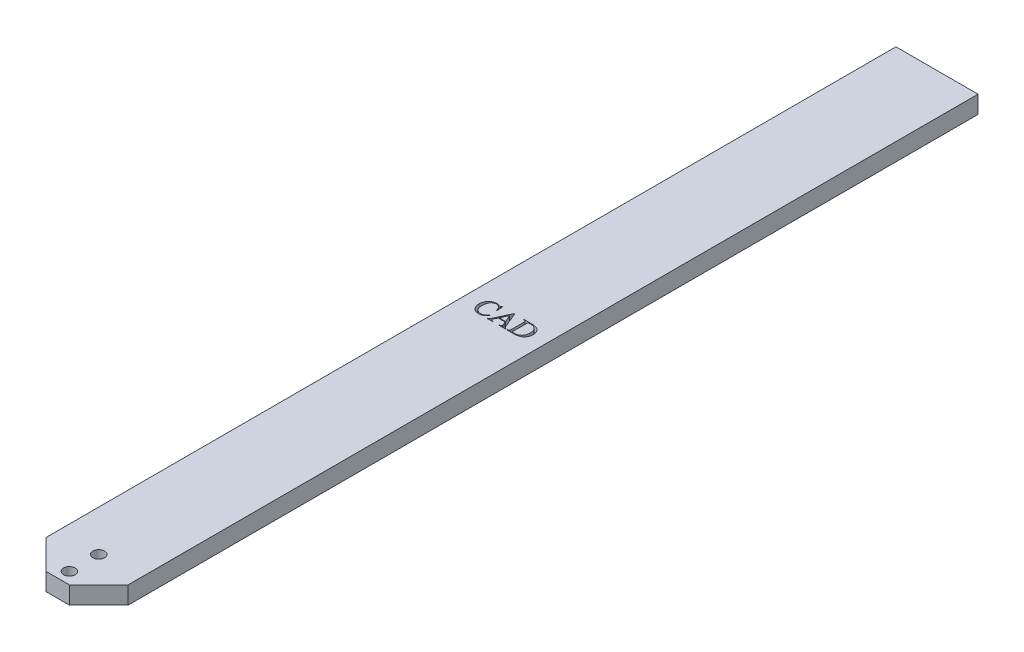
from build123d import *

# Parameters (mm, degrees)
SKETCH2_W           = 14
SKETCH2_H           = 3
BOSS_EXTRUDE1_DEPTH = 150
SKETCH3_R           = 1
CUT_EXTRUDE1_DEPTH  = 151.193208901
CHAMFER1_SIZE       = 5
CUT_EXTRUDE2_DEPTH  = 1
SKETCH5_R           = 1
CUT_EXTRUDE3_DEPTH  = 151.193209006


with BuildPart() as part:
    # Sketch2 → Boss-Extrude1 (new body)
    with BuildSketch(Plane.XY):
        Rectangle(SKETCH2_W, SKETCH2_H)
    extrude(amount=BOSS_EXTRUDE1_DEPTH)

    # Sketch3 → Cut-Extrude1 (cut, through all)
    with BuildSketch(Plane(origin=(0, 1.5, 0), x_dir=(1, 0, 0), z_dir=(0, 1, 0))):
        with Locations(Location((0, -148, 0), (0, 0, 270))):
            Circle(SKETCH3_R)
    extrude(amount=-CUT_EXTRUDE1_DEPTH, mode=Mode.SUBTRACT)

    # Chamfer1
    chamfer1_edges = [part.edges().sort_by_distance(p)[0] for p in [
        (-7, 0, 150),
        (7, 0, 150),
    ]]
    chamfer(chamfer1_edges, length=CHAMFER1_SIZE)

    # Sketch4 → Cut-Extrude2 (cut)
    # profile 1 of 3: a face of its own
    with BuildSketch(Plane(origin=(0, 1.5, 0), x_dir=(1, 0, 0), z_dir=(0, 1, 0))):
        with BuildLine():
            Line((-2.125, -71.958333333), (-2.041666667, -73))
            Line((-2.041666667, -73), (-2.125, -73))
            add(Edge.make_bspline(
                [(-2.125, -73), (-2.136076678, -72.960588211), (-2.157536132, -72.884233601), (-2.195799915, -72.775086784), (-2.236125252, -72.674026209), (-2.281364478, -72.581998347), (-2.329301749, -72.498082286), (-2.381514813, -72.423040121), (-2.436868105, -72.356184393), (-2.495788541, -72.297772034), (-2.55821585, -72.247345156), (-2.62342667, -72.203655515), (-2.691541511, -72.16621677), (-2.762726043, -72.135425808), (-2.83733221, -72.111797909), (-2.915090705, -72.096130786), (-2.995551586, -72.08487635), (-3.050306534, -72.083853166), (-3.078125, -72.083333333)],
                knots=[0, 0, 0, 0, 1.365306606, 2.645083058, 3.856296657, 4.992683601, 6.063002854, 7.077131597, 8.038305781, 8.954596039, 9.839848101, 10.711227855, 11.569763097, 12.429061007, 13.294496621, 14.174761977, 15.072680662, 16, 16, 16, 16], degree=3))
            add(Edge.make_bspline(
                [(-3.078125, -72.083333333), (-3.101572706, -72.083946335), (-3.147904256, -72.085157597), (-3.216530095, -72.091392832), (-3.283229087, -72.10349916), (-3.348494939, -72.119348063), (-3.411677731, -72.141489801), (-3.473874766, -72.16638552), (-3.533718209, -72.197361867), (-3.591995382, -72.232530711), (-3.647937593, -72.272777764), (-3.701065517, -72.318566332), (-3.750417331, -72.370271808), (-3.797205749, -72.427388), (-3.840104897, -72.490599483), (-3.881839341, -72.558269798), (-3.918487879, -72.632520256), (-3.953192391, -72.711605675), (-3.983526062, -72.796307036), (-4.010259476, -72.885835873), (-4.033141909, -72.98010835), (-4.050889174, -73.079773984), (-4.066465283, -73.184105817), (-4.075313982, -73.293945879), (-4.082524408, -73.408325087), (-4.08306034, -73.486315102), (-4.083333333, -73.526041667)],
                knots=[0, 0, 0, 0, 0.852545564, 1.684589362, 2.501652392, 3.314783632, 4.123040609, 4.933143274, 5.748109165, 6.569312519, 7.405645712, 8.25016084, 9.114918083, 10.000754889, 10.930732154, 11.889927012, 12.888317242, 13.937610583, 15.028084188, 16.156171809, 17.332859433, 18.552090647, 19.835038534, 21.165583881, 22.556204723, 24, 24, 24, 24], degree=3))
            add(Edge.make_bspline(
                [(-4.083333333, -73.526041667), (-4.082968121, -73.5590365), (-4.082249119, -73.623994336), (-4.076291433, -73.719576463), (-4.066544755, -73.811902478), (-4.052966691, -73.900776186), (-4.035620897, -73.986521783), (-4.013126972, -74.068475079), (-3.987914966, -74.147482045), (-3.95888766, -74.223178296), (-3.924858473, -74.294485287), (-3.887797928, -74.362239559), (-3.846120173, -74.425317293), (-3.800258304, -74.484165678), (-3.75085134, -74.538999387), (-3.697293159, -74.589319631), (-3.639618235, -74.634986119), (-3.578526475, -74.676627686), (-3.514164215, -74.713745681), (-3.447066373, -74.745627714), (-3.377755665, -74.772273516), (-3.306448125, -74.794545243), (-3.232967038, -74.812176311), (-3.157031662, -74.82455089), (-3.078914134, -74.831691834), (-3.026056009, -74.832782344), (-2.999348958, -74.833333333)],
                knots=[0, 0, 0, 0, 1.236646645, 2.434620225, 3.588021171, 4.71542926, 5.803413575, 6.864987612, 7.89909351, 8.911178466, 9.900886288, 10.858450138, 11.803739474, 12.731186558, 13.652621421, 14.567606934, 15.482266978, 16.407285251, 17.336514176, 18.264317902, 19.188799549, 20.117565524, 21.062609844, 22.018756131, 22.998958452, 24, 24, 24, 24], degree=3))
            add(Edge.make_bspline(
                [(-2.999348958, -74.833333333), (-2.953679471, -74.832087924), (-2.864379759, -74.829652716), (-2.734730494, -74.806820656), (-2.613151187, -74.770553953), (-2.51771662, -74.727243337), (-2.444916386, -74.682697603), (-2.388483921, -74.642840237), (-2.331452837, -74.594945861), (-2.272792254, -74.540163715), (-2.213022677, -74.477868645), (-2.15092925, -74.409131832), (-2.088878021, -74.332083544), (-2.047818193, -74.277885277), (-2.026692708, -74.25)],
                knots=[0, 0, 0, 0, 1.384369864, 2.706923932, 3.979392615, 5.225429667, 5.872362172, 6.566477539, 7.319183729, 8.12964106, 9.000244434, 9.937306366, 10.938733914, 12, 12, 12, 12], degree=3))
            Line((-2.026692708, -74.25), (-1.958333333, -74.291666667))
            add(Edge.make_bspline(
                [(-1.958333333, -74.291666667), (-1.976727695, -74.323079849), (-2.012855253, -74.384777104), (-2.070556436, -74.472727123), (-2.131257384, -74.553809869), (-2.194707197, -74.628010263), (-2.259362954, -74.69663049), (-2.327077128, -74.758098555), (-2.39640875, -74.813840756), (-2.469311429, -74.862000703), (-2.54443781, -74.90473231), (-2.623135753, -74.941251322), (-2.704918676, -74.972409803), (-2.790166008, -74.998079249), (-2.879038026, -75.017350994), (-2.971193711, -75.031662386), (-3.06688821, -75.040384431), (-3.131708963, -75.041234062), (-3.164713542, -75.041666667)],
                knots=[0, 0, 0, 0, 1.164115463, 2.286388121, 3.362177995, 4.401064794, 5.407448869, 6.375280312, 7.323730291, 8.2496411, 9.166480924, 10.085577234, 11.021398032, 11.963401182, 12.930012424, 13.927332932, 14.944666635, 16, 16, 16, 16], degree=3))
            add(Edge.make_bspline(
                [(-3.164713542, -75.041666667), (-3.194458036, -75.041363683), (-3.25315314, -75.040765802), (-3.33982857, -75.033859996), (-3.424178298, -75.02364034), (-3.506008115, -75.008947665), (-3.585037647, -74.988707145), (-3.662064837, -74.966851052), (-3.735797914, -74.938043871), (-3.807310032, -74.906592926), (-3.876193088, -74.870381674), (-3.942653071, -74.830144132), (-4.006385394, -74.785053296), (-4.067674498, -74.736135299), (-4.12660686, -74.683316204), (-4.182556242, -74.625585865), (-4.236724369, -74.564238257), (-4.269816794, -74.52019525), (-4.286458333, -74.498046875)],
                knots=[0, 0, 0, 0, 1.099867591, 2.170379506, 3.21370673, 4.241732154, 5.242319988, 6.230208013, 7.200627964, 8.167156574, 9.118536317, 10.076596279, 11.038581839, 12.003776478, 12.975622664, 13.963217193, 14.975741399, 16, 16, 16, 16], degree=3))
            add(Edge.make_bspline(
                [(-4.286458333, -74.498046875), (-4.310314431, -74.463945397), (-4.357686132, -74.396229165), (-4.417455033, -74.287509866), (-4.469161687, -74.175203738), (-4.510903831, -74.057711128), (-4.543619967, -73.936047298), (-4.565851839, -73.809652362), (-4.581049507, -73.67918903), (-4.582564745, -73.590539461), (-4.583333333, -73.545572917)],
                knots=[0, 0, 0, 0, 0.983524538, 1.953011393, 2.929009533, 3.904562341, 4.897931762, 5.904535192, 6.937097918, 8, 8, 8, 8], degree=3))
            add(Edge.make_bspline(
                [(-4.583333333, -73.545572917), (-4.582607524, -73.509099982), (-4.58117128, -73.436926639), (-4.572748712, -73.329716228), (-4.557960437, -73.224855034), (-4.535945267, -73.122446811), (-4.509670706, -73.021773577), (-4.476247236, -72.923597307), (-4.437223849, -72.827665666), (-4.392163436, -72.734753829), (-4.342585597, -72.644998416), (-4.286947915, -72.560572627), (-4.227750264, -72.480696093), (-4.163761201, -72.406309248), (-4.095256315, -72.337102861), (-4.022150437, -72.27313816), (-3.944467219, -72.214418138), (-3.862636796, -72.161163619), (-3.777410104, -72.113891049), (-3.690172185, -72.071951701), (-3.600737415, -72.036734744), (-3.509368772, -72.008011949), (-3.416238794, -71.985843744), (-3.321144565, -71.970383439), (-3.224182338, -71.960132992), (-3.158663331, -71.958936298), (-3.125651042, -71.958333333)],
                knots=[0, 0, 0, 0, 1.092083487, 2.161035764, 3.217773312, 4.260190825, 5.295679875, 6.331270849, 7.362920202, 8.394590017, 9.421399, 10.430623911, 11.419565072, 12.396371527, 13.365824252, 14.332813307, 15.302266032, 16.279072486, 17.253498857, 18.218389939, 19.175218244, 20.128753647, 21.083815363, 22.038788663, 23.011827579, 24, 24, 24, 24], degree=3))
            add(Edge.make_bspline(
                [(-3.125651042, -71.958333333), (-3.073901985, -71.95977735), (-2.970063266, -71.962674887), (-2.815525815, -71.988138245), (-2.661652419, -72.027189972), (-2.562571611, -72.066181465), (-2.512369792, -72.0859375)],
                knots=[0, 0, 0, 0, 0.984356359, 1.975191602, 2.974079167, 4, 4, 4, 4], degree=3))
            add(Edge.make_bspline(
                [(-2.512369792, -72.0859375), (-2.498755523, -72.091732806), (-2.473706163, -72.102395789), (-2.438998527, -72.114729788), (-2.410501558, -72.122789279), (-2.393479788, -72.124329371), (-2.386067708, -72.125)],
                knots=[0, 0, 0, 0, 1.336236462, 2.458587416, 3.328796419, 4, 4, 4, 4], degree=3))
            add(Edge.make_bspline(
                [(-2.386067708, -72.125), (-2.367765576, -72.12366012), (-2.331606149, -72.121012925), (-2.301383672, -72.101019544), (-2.286458333, -72.091145833)],
                knots=[0, 0, 0, 0, 1.012302122, 2, 2, 2, 2], degree=3))
            add(Edge.make_bspline(
                [(-2.286458333, -72.091145833), (-2.277650412, -72.082760823), (-2.259658775, -72.065633051), (-2.238739886, -72.033786951), (-2.220459955, -71.998127154), (-2.212483014, -71.971950617), (-2.208333333, -71.958333333)],
                knots=[0, 0, 0, 0, 0.931295945, 1.90232619, 2.908770141, 4, 4, 4, 4], degree=3))
            Line((-2.208333333, -71.958333333), (-2.125, -71.958333333))
        make_face()
    # profile 2 of 3: a face of its own
    with BuildSketch(Plane(origin=(0, 1.5, 0), x_dir=(1, 0, 0), z_dir=(0, 1, 0))):
        with BuildLine():
            Line((0.33203125, -74), (-0.863932292, -74))
            Line((-0.863932292, -74), (-1.083333333, -74.47265625))
            add(Edge.make_bspline(
                [(-1.083333333, -74.47265625), (-1.094538522, -74.499437804), (-1.115205077, -74.548833001), (-1.138726711, -74.618786003), (-1.15479328, -74.677888872), (-1.157157011, -74.714337646), (-1.158203125, -74.73046875)],
                knots=[0, 0, 0, 0, 1.290094603, 2.37941668, 3.282779777, 4, 4, 4, 4], degree=3))
            add(Edge.make_bspline(
                [(-1.158203125, -74.73046875), (-1.157550012, -74.741673208), (-1.156252136, -74.76393887), (-1.142453882, -74.795639785), (-1.122039838, -74.825122716), (-1.09857791, -74.847752647), (-1.0743209, -74.863532283), (-1.050957085, -74.874756684), (-1.022737507, -74.88435532), (-0.989733985, -74.892380832), (-0.952188791, -74.900281042), (-0.910130466, -74.907638018), (-0.863105702, -74.912365976), (-0.830297427, -74.915190502), (-0.813151042, -74.916666667)],
                knots=[0, 0, 0, 0, 0.928346294, 1.844823155, 2.832693264, 3.906787277, 4.533555799, 5.236980931, 6.060283213, 7.011752617, 8.064797478, 9.256587662, 10.566227436, 12, 12, 12, 12], degree=3))
            Line((-0.813151042, -74.916666667), (-0.813151042, -75))
            Line((-0.813151042, -75), (-1.755208333, -75))
            Line((-1.755208333, -75), (-1.755208333, -74.916666667))
            add(Edge.make_bspline(
                [(-1.755208333, -74.916666667), (-1.726663044, -74.910815018), (-1.674764384, -74.900176038), (-1.605685654, -74.879729324), (-1.552010046, -74.85704646), (-1.525303373, -74.835992501), (-1.513671875, -74.826822917)],
                knots=[0, 0, 0, 0, 1.341417684, 2.438853554, 3.320077337, 4, 4, 4, 4], degree=3))
            add(Edge.make_bspline(
                [(-1.513671875, -74.826822917), (-1.503948012, -74.816559538), (-1.48326164, -74.794725408), (-1.453885106, -74.756349221), (-1.424219897, -74.710677788), (-1.393847254, -74.657949401), (-1.362474538, -74.598174544), (-1.330090321, -74.531629978), (-1.297522199, -74.457400907), (-1.276148489, -74.405427677), (-1.264973958, -74.378255208)],
                knots=[0, 0, 0, 0, 0.657509844, 1.398774721, 2.244567789, 3.190193186, 4.229071695, 5.385194885, 6.63293641, 8, 8, 8, 8], degree=3))
            Line((-1.264973958, -74.378255208), (-0.139973958, -71.958333333))
            Line((-0.139973958, -71.958333333), (-0.057942708, -71.958333333))
            Line((-0.057942708, -71.958333333), (0.958333333, -74.430989583))
            add(Edge.make_bspline(
                [(0.958333333, -74.430989583), (0.968316221, -74.454742066), (0.987515739, -74.50042386), (1.018643302, -74.564674348), (1.04730199, -74.623297797), (1.076111971, -74.674935254), (1.103973108, -74.720031084), (1.131247263, -74.758621195), (1.157810379, -74.790859991), (1.192806086, -74.825072948), (1.241462181, -74.859686808), (1.309346553, -74.888401761), (1.386280334, -74.909045625), (1.441267366, -74.914048009), (1.470052083, -74.916666667)],
                knots=[0, 0, 0, 0, 1.223989839, 2.354029848, 3.391605643, 4.324042249, 5.162387765, 5.909171864, 6.567979791, 7.144041755, 8.231258465, 9.380841669, 10.628917946, 12, 12, 12, 12], degree=3))
            Line((1.470052083, -74.916666667), (1.470052083, -75))
            Line((1.470052083, -75), (0.285807292, -75))
            Line((0.285807292, -75), (0.285807292, -74.916666667))
            add(Edge.make_bspline(
                [(0.285807292, -74.916666667), (0.313229986, -74.914905379), (0.363614687, -74.911669302), (0.431418197, -74.898577036), (0.485868541, -74.882309888), (0.526113223, -74.858125215), (0.554591835, -74.82956858), (0.574572973, -74.798482022), (0.587053265, -74.764360179), (0.588474179, -74.740553966), (0.589192708, -74.728515625)],
                knots=[0, 0, 0, 0, 1.654818352, 3.040457217, 4.157564338, 5.061856313, 5.838989301, 6.56851638, 7.276126429, 8, 8, 8, 8], degree=3))
            add(Edge.make_bspline(
                [(0.589192708, -74.728515625), (0.588022944, -74.709332246), (0.585356853, -74.665610105), (0.565906264, -74.593880971), (0.539135112, -74.507395618), (0.514596739, -74.446015551), (0.501302083, -74.412760417)],
                knots=[0, 0, 0, 0, 0.698820548, 1.592729354, 2.695763756, 4, 4, 4, 4], degree=3))
            Line((0.501302083, -74.412760417), (0.33203125, -74))
        make_face()
        Polygon((0.280598958, -73.875), (-0.229166667, -72.670572917), (-0.805989583, -73.875), align=None, mode=Mode.SUBTRACT)
    # profile 3 of 3: a face of its own
    with BuildSketch(Plane(origin=(0, 1.5, 0), x_dir=(1, 0, 0), z_dir=(0, 1, 0))):
        with BuildLine():
            Line((1.541666667, -75), (1.541666667, -74.916666667))
            Line((1.541666667, -74.916666667), (1.650390625, -74.916666667))
            add(Edge.make_bspline(
                [(1.650390625, -74.916666667), (1.665167649, -74.916317918), (1.693760704, -74.915643102), (1.7350316, -74.909721419), (1.773049558, -74.899999784), (1.807839874, -74.88657677), (1.838710943, -74.868346991), (1.867300222, -74.847857875), (1.891599207, -74.821937978), (1.904779802, -74.802278867), (1.911458333, -74.792317708)],
                knots=[0, 0, 0, 0, 1.170016541, 2.263943595, 3.293731011, 4.273677885, 5.205400736, 6.126759273, 7.050839703, 8, 8, 8, 8], degree=3))
            add(Edge.make_bspline(
                [(1.911458333, -74.792317708), (1.915340396, -74.785245757), (1.923886423, -74.769677463), (1.93331075, -74.741992272), (1.940726931, -74.708762384), (1.947309064, -74.669861847), (1.952211019, -74.625295361), (1.956311431, -74.574721716), (1.957931788, -74.518456686), (1.958195642, -74.478949766), (1.958333333, -74.458333333)],
                knots=[0, 0, 0, 0, 0.568141805, 1.250715472, 2.052584266, 2.968455247, 4.031571596, 5.213625719, 6.545948453, 8, 8, 8, 8], degree=3))
            Line((1.958333333, -74.458333333), (1.958333333, -72.541666667))
            add(Edge.make_bspline(
                [(1.958333333, -72.541666667), (1.958363906, -72.518873056), (1.958421887, -72.475645816), (1.95468919, -72.414015206), (1.95060326, -72.359012536), (1.944220886, -72.310738561), (1.935901495, -72.269097752), (1.925535958, -72.234352203), (1.914591875, -72.205127147), (1.903524939, -72.189929173), (1.8984375, -72.182942708)],
                knots=[0, 0, 0, 0, 1.484107705, 2.814555366, 4.019988359, 5.075390106, 5.984573864, 6.780592097, 7.4394417, 8, 8, 8, 8], degree=3))
            add(Edge.make_bspline(
                [(1.8984375, -72.182942708), (1.88350745, -72.16753854), (1.853493792, -72.136571768), (1.794303054, -72.105021625), (1.725478091, -72.086829249), (1.676338261, -72.084541401), (1.650390625, -72.083333333)],
                knots=[0, 0, 0, 0, 0.928124107, 1.865794122, 2.873060895, 4, 4, 4, 4], degree=3))
            Line((1.650390625, -72.083333333), (1.541666667, -72.083333333))
            Line((1.541666667, -72.083333333), (1.541666667, -72))
            Line((1.541666667, -72), (2.770833333, -72))
            add(Edge.make_bspline(
                [(2.770833333, -72), (2.825529491, -72.000514028), (2.931714973, -72.001511948), (3.085878648, -72.008779003), (3.230134911, -72.020092779), (3.363956204, -72.03688783), (3.48778767, -72.058428023), (3.601683016, -72.083891121), (3.705454699, -72.11506777), (3.799879317, -72.15125281), (3.887370299, -72.192718784), (3.969205459, -72.241073374), (4.046930064, -72.295227296), (4.120538382, -72.355493288), (4.189234557, -72.422650344), (4.254115283, -72.495791666), (4.313975903, -72.575749588), (4.369708508, -72.661063033), (4.419843866, -72.751536275), (4.463413677, -72.846036501), (4.500561709, -72.943939809), (4.531419184, -73.045203142), (4.554846507, -73.150122893), (4.570566703, -73.258540125), (4.581778623, -73.370209515), (4.58280985, -73.445934596), (4.583333333, -73.484375)],
                knots=[0, 0, 0, 0, 1.467398357, 2.848763231, 4.139747069, 5.348651221, 6.465709142, 7.510884705, 8.477890948, 9.369935066, 10.221521294, 11.072291092, 11.917022873, 12.760911509, 13.621447043, 14.491775058, 15.381421868, 16.298684439, 17.223858558, 18.153856654, 19.088127867, 20.031156851, 20.991691223, 21.969088183, 22.969046064, 24, 24, 24, 24], degree=3))
            add(Edge.make_bspline(
                [(4.583333333, -73.484375), (4.582324136, -73.535649799), (4.580346063, -73.636150759), (4.561355003, -73.783585464), (4.531691155, -73.924583734), (4.490064683, -74.059466604), (4.435754756, -74.187626242), (4.36934339, -74.309223028), (4.292437903, -74.425503155), (4.231282716, -74.495859707), (4.200520833, -74.53125)],
                knots=[0, 0, 0, 0, 1.077719575, 2.112379846, 3.120154608, 4.104514829, 5.075810074, 6.041644454, 7.014920789, 8, 8, 8, 8], degree=3))
            add(Edge.make_bspline(
                [(4.200520833, -74.53125), (4.182323015, -74.55038199), (4.145798064, -74.588781922), (4.08644692, -74.641872391), (4.023885419, -74.691517935), (3.957690494, -74.737267049), (3.888164166, -74.779504449), (3.814975818, -74.818176424), (3.737978157, -74.852346535), (3.657955, -74.883840256), (3.574159052, -74.911044025), (3.487106783, -74.935180867), (3.396282541, -74.955427084), (3.30191503, -74.971365595), (3.204236172, -74.98458252), (3.103007503, -74.993606937), (2.998317898, -74.998739294), (2.92730594, -74.999575651), (2.891276042, -75)],
                knots=[0, 0, 0, 0, 0.884547214, 1.775380039, 2.665826882, 3.559504879, 4.469980105, 5.390593375, 6.331323642, 7.291529335, 8.271228182, 9.282197471, 10.317896576, 11.387954191, 12.488469157, 13.620281033, 14.792583212, 16, 16, 16, 16], degree=3))
            Line((2.891276042, -75), (1.541666667, -75))
        make_face()
        with BuildLine():
            add(Edge.make_bspline(
                [(2.375, -74.811197917), (2.42113315, -74.821035719), (2.509152757, -74.839805724), (2.636383667, -74.85873335), (2.751651149, -74.872581549), (2.824834913, -74.874224559), (2.859375, -74.875)],
                knots=[0, 0, 0, 0, 1.156263879, 2.206090244, 3.153339526, 4, 4, 4, 4], degree=3))
            add(Edge.make_bspline(
                [(2.859375, -74.875), (2.902408422, -74.87392685), (2.987108386, -74.871814635), (3.11114041, -74.853583768), (3.229906875, -74.825174635), (3.343043763, -74.784681043), (3.450448024, -74.732278756), (3.551998621, -74.668107772), (3.647208719, -74.591752454), (3.737159211, -74.505718059), (3.818053891, -74.408808579), (3.889693829, -74.303531631), (3.949636129, -74.189642348), (3.998541828, -74.067600681), (4.037091132, -73.937513868), (4.064082777, -73.798877286), (4.080663328, -73.652098438), (4.082429676, -73.551477377), (4.083333333, -73.5)],
                knots=[0, 0, 0, 0, 0.997996022, 1.964292496, 2.902202989, 3.827540679, 4.746320531, 5.669683403, 6.608607029, 7.573643287, 8.552931756, 9.531909504, 10.522958759, 11.532773866, 12.577887131, 13.666093008, 14.805981493, 16, 16, 16, 16], degree=3))
            add(Edge.make_bspline(
                [(4.083333333, -73.5), (4.082431779, -73.448089353), (4.080672989, -73.346819876), (4.064156757, -73.199376045), (4.036996915, -73.060341291), (3.998534214, -72.929811735), (3.949767581, -72.807268305), (3.889841908, -72.693332862), (3.818069809, -72.588533345), (3.736888062, -72.492367991), (3.647322687, -72.405843212), (3.55059034, -72.330575298), (3.447489999, -72.267031288), (3.338436978, -72.214258901), (3.222253925, -72.175193823), (3.100875804, -72.145282827), (2.972912084, -72.128426316), (2.885680806, -72.126158042), (2.841145833, -72.125)],
                knots=[0, 0, 0, 0, 1.193396302, 2.328127765, 3.406675227, 4.447298146, 5.452780722, 6.435033879, 7.401194227, 8.367973033, 9.324444072, 10.259799173, 11.180785527, 12.104889921, 13.03919269, 13.994204462, 14.975963072, 16, 16, 16, 16], degree=3))
            add(Edge.make_bspline(
                [(2.841145833, -72.125), (2.805957642, -72.125773543), (2.732776119, -72.127382293), (2.619699695, -72.14053948), (2.49935203, -72.161521474), (2.417444913, -72.180776897), (2.375, -72.190755208)],
                knots=[0, 0, 0, 0, 0.894670856, 1.860663297, 2.891378894, 4, 4, 4, 4], degree=3))
            Line((2.375, -72.190755208), (2.375, -74.811197917))
        make_face(mode=Mode.SUBTRACT)
    extrude(amount=-CUT_EXTRUDE2_DEPTH, mode=Mode.SUBTRACT)

    # Sketch5 → Cut-Extrude3 (cut, through all)
    with BuildSketch(Plane(origin=(0, 1.5, 0), x_dir=(1, 0, 0), z_dir=(0, 1, 0))):
        with Locations(Location((0, -143, 0), (0, 0, 270))):
            Circle(SKETCH5_R)
    extrude(amount=-CUT_EXTRUDE3_DEPTH, mode=Mode.SUBTRACT)


solid = part.part
